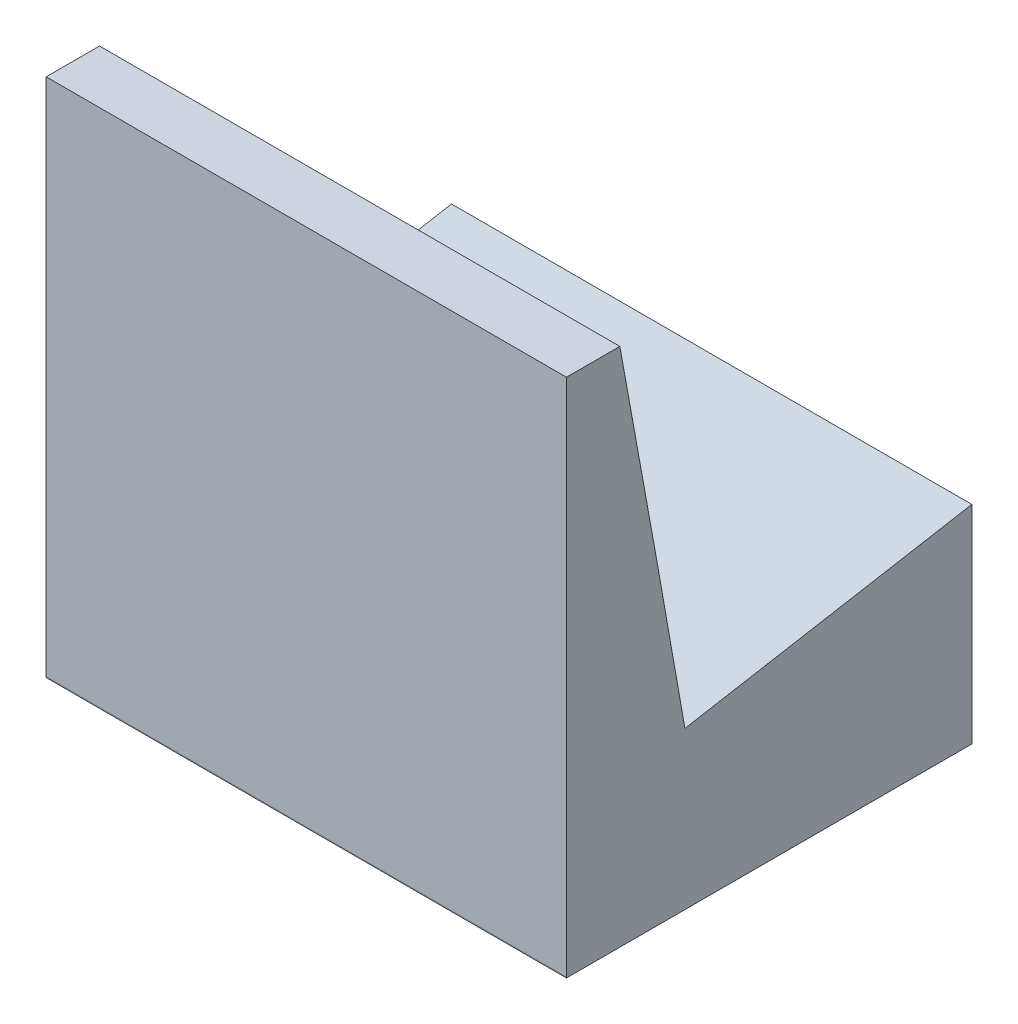
from build123d import *

# Parameters (mm, degrees)
SKETCH1_W           = 78
SKETCH1_H           = 78
BOSS_EXTRUDE1_DEPTH = 78
CUT_EXTRUDE2_DEPTH  = 118
SKETCH3_W           = 78
SKETCH3_H           = 17.233329778
CUT_EXTRUDE3_DEPTH  = 96.269447677


with BuildPart() as part:
    # Sketch1 → Boss-Extrude1 (new body)
    with BuildSketch(Plane(origin=(0, 0, 0), x_dir=(1, 0, 0), z_dir=(0, 1, 0))):
        Rectangle(SKETCH1_W, SKETCH1_H)
    extrude(amount=BOSS_EXTRUDE1_DEPTH)

    # Sketch2 → Cut-Extrude2 (cut, through all)
    with BuildSketch(Plane(origin=(39, 0, 0), x_dir=(0, 0, -1), z_dir=(1, 0, 0))):
        Polygon((-21.767253197, 0.141749363), (-21.767253197, 78), (-39, 78), (-39, 0), align=None)
        Polygon((-4.012108483, 23.522620279), (39, 31.106815501), (39, 78), (-13.767253197, 78), (-8.378409218, 48.285142253), align=None)
    extrude(amount=-CUT_EXTRUDE2_DEPTH, mode=Mode.SUBTRACT)

    # Sketch3 → Cut-Extrude3 (cut, through all)
    with BuildSketch(Plane(origin=(0, 0.320775974, 0.002638569), x_dir=(1, 0, 0), z_dir=(0, 0.9999661716212329, 0.00822530322693927))):
        with Locations((0, -30.382015804)):
            Rectangle(SKETCH3_W, SKETCH3_H)
    extrude(amount=-CUT_EXTRUDE3_DEPTH, mode=Mode.SUBTRACT)


solid = part.part
